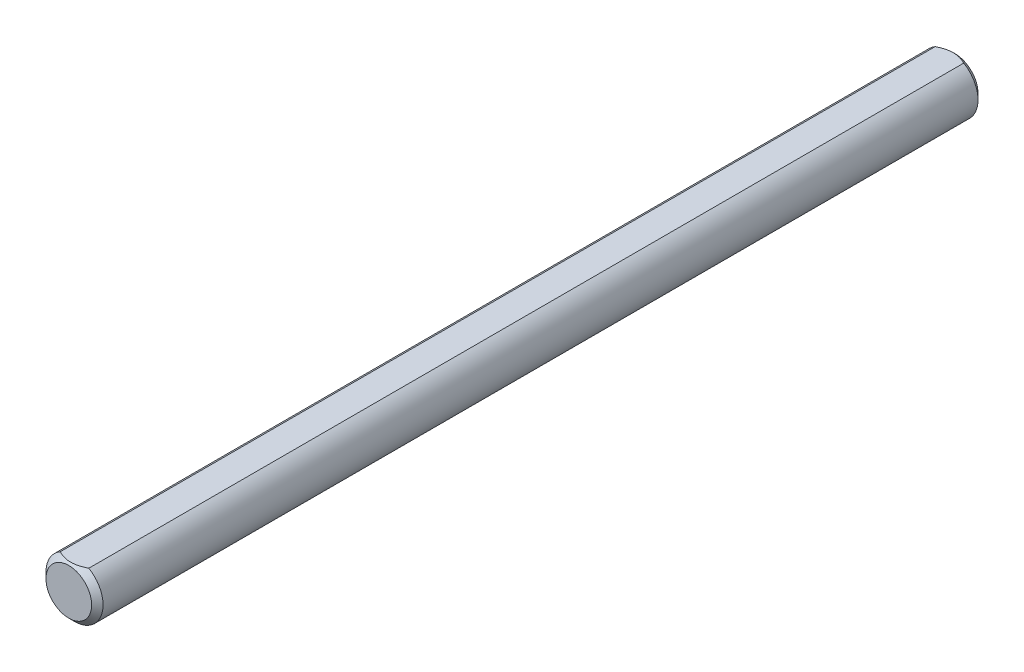
from build123d import *

# Parameters (mm, degrees)
SKETCH1_R           = 3.175
EXTRUDE1_DEPTH      = 49.276
CHAMFER1_SIZE       = 0.635
EXTRUDE7_DEPTH      = 50.480151839
EXTRUDE7_DEPTH_BACK = 50.480151839


with BuildPart() as part:
    # Sketch1 → Extrude1 (new, symmetric)
    with BuildSketch(Plane.XY):
        with Locations(Location((0, 0, 0), (0, 0, 180))):
            Circle(SKETCH1_R)
    extrude(amount=EXTRUDE1_DEPTH, both=True)

    # Chamfer1
    chamfer1_edges = [part.edges().sort_by_distance(p)[0] for p in [
        (3.175, 0, -49.276),
        (3.175, 0, 49.276),
    ]]
    chamfer(chamfer1_edges, length=CHAMFER1_SIZE)

    # Sketch13 → Extrude7 (cut, two sides: drawn at the far end of the back side and taken through both)
    with BuildSketch(Plane.XY.offset(-EXTRUDE7_DEPTH_BACK)):
        with BuildLine():
            Line((-1.5875, 2.749630657), (1.5875, 2.749630657))
            ThreePointArc((1.5875, 2.749630657), (0, 3.175), (-1.5875, 2.749630657))
        make_face()
    extrude(amount=EXTRUDE7_DEPTH + EXTRUDE7_DEPTH_BACK, mode=Mode.SUBTRACT)


solid = part.part
